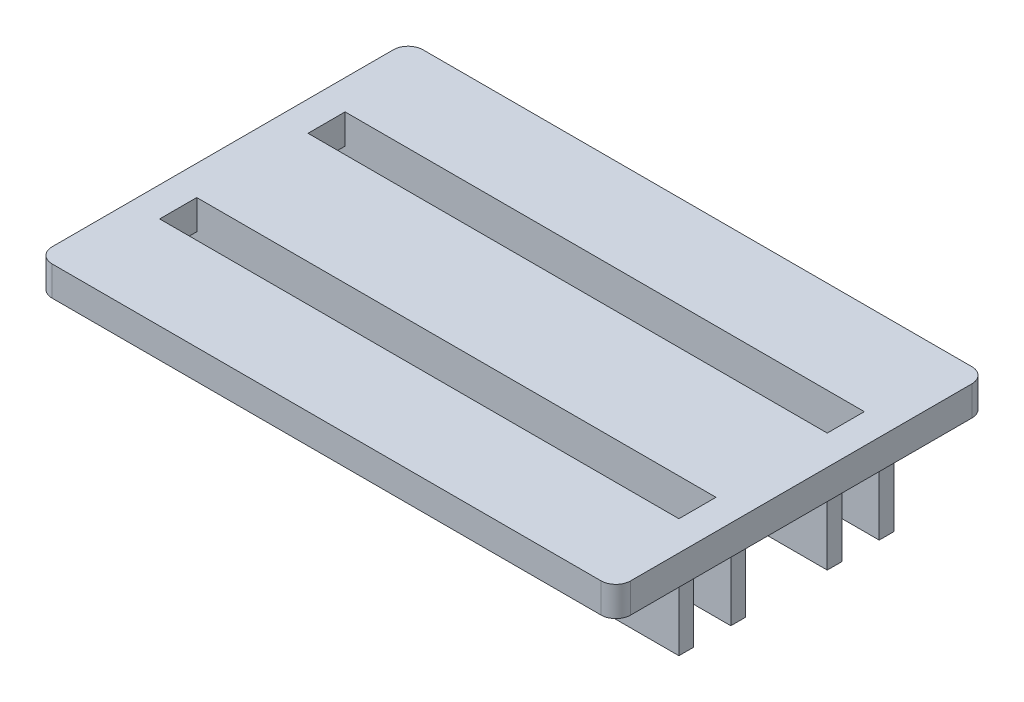
from build123d import *

# Parameters (mm, degrees)
BOSS_EXTRUDE1_DEPTH = 5.08
SKETCH4_W           = 88.9
SKETCH4_H           = 6.35
CUT_EXTRUDE2_DEPTH  = 5.08
SKETCH6_W           = 2.54
SKETCH6_H           = 12.7
BOSS_EXTRUDE2_DEPTH = 46.99


with BuildPart() as part:
    # Sketch2 → Boss-Extrude1 (new body)
    with BuildSketch(Plane(origin=(0, 0, 0), x_dir=(1, 0, 0), z_dir=(0, 1, 0))):
        with BuildLine():
            Line((-46.99, 31.75), (46.99, 31.75))
            ThreePointArc((46.99, 31.75), (48.786051224, 31.006051224), (49.53, 29.21))
            Line((49.53, 29.21), (49.53, -29.21))
            ThreePointArc((49.53, -29.21), (48.786051224, -31.006051224), (46.99, -31.75))
            Line((46.99, -31.75), (-46.99, -31.75))
            ThreePointArc((-46.99, -31.75), (-48.786051224, -31.006051224), (-49.53, -29.21))
            Line((-49.53, -29.21), (-49.53, 29.21))
            ThreePointArc((-49.53, 29.21), (-48.786051224, 31.006051224), (-46.99, 31.75))
        make_face()
    extrude(amount=BOSS_EXTRUDE1_DEPTH)

    # Sketch4 → Cut-Extrude2 (cut)
    with BuildSketch(Plane(origin=(0, 0, 0), x_dir=(1, 0, 0), z_dir=(0, 1, 0))):
        with Locations((0, 12.7)):
            Rectangle(SKETCH4_W, SKETCH4_H)
        with Locations((0, -12.7)):
            Rectangle(SKETCH4_W, SKETCH4_H)
    extrude(amount=CUT_EXTRUDE2_DEPTH, mode=Mode.SUBTRACT)

    # Sketch6 → Boss-Extrude2 (add, symmetric)
    with BuildSketch(Plane(origin=(0, 0, 0), x_dir=(0, 0, -1), z_dir=(1, 0, 0))):
        with Locations((-17.145, -6.35)):
            Rectangle(SKETCH6_W, SKETCH6_H)
        with Locations((-8.255, -6.35)):
            Rectangle(SKETCH6_W, SKETCH6_H)
        with Locations((8.255, -6.35)):
            Rectangle(SKETCH6_W, SKETCH6_H)
        with Locations((17.145, -6.35)):
            Rectangle(SKETCH6_W, SKETCH6_H)
    extrude(amount=BOSS_EXTRUDE2_DEPTH, both=True)


solid = part.part
